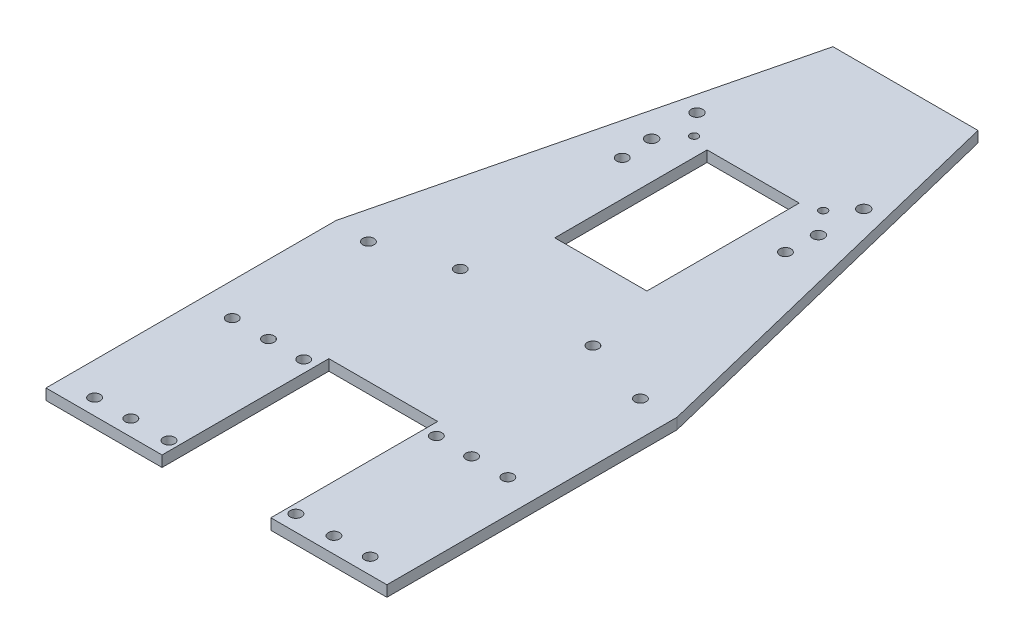
from build123d import *

# Parameters (mm, degrees)
BODY_DEPTH             = 3
SKETCH4_R              = 1.55
MOTOR_MOUNT_DEPTH      = 3
SKETCH5_R              = 1.1
SKETCH5_W              = 25.4
SKETCH5_H              = 42
PROTOBOARD_MOUNT_DEPTH = 10
SKETCH6_R              = 1.6
CASTER_MOUNT_DEPTH     = 10
SKETCH8_R              = 1.55
STAND_OFF_MOUNT_DEPTH  = 10


with BuildPart() as part:
    # Sketch3 → Body (new body)
    with BuildSketch(Plane(origin=(0, 0, 0), x_dir=(1, 0, 0), z_dir=(0, 1, 0))):
        Polygon((-15, -46), (-47, -46), (-47, 34), (-20, 144), (20, 144), (47, 34), (47, -46), (15, -46), (15, 0), (-15, 0), align=None)
    extrude(amount=BODY_DEPTH)

    # Sketch4 → Motor Mount (cut)
    with BuildSketch(Plane(origin=(0, 3, 0), x_dir=(1, 0, 0), z_dir=(0, 1, 0))):
        with Locations(Location((-38, -3.65, 0), (0, 0, 270))):
            Circle(SKETCH4_R)
        with Locations(Location((-28, -3.65, 0), (0, 0, 270))):
            Circle(SKETCH4_R)
        with Locations(Location((-38, -41.6, 0), (0, 0, 270))):
            Circle(SKETCH4_R)
        with Locations(Location((-28, -41.6, 0), (0, 0, 270))):
            Circle(SKETCH4_R)
        with Locations(Location((-18.29, -3.65, 0), (0, 0, 270))):
            Circle(SKETCH4_R)
        with Locations(Location((18.29, -3.65, 0), (0, 0, 90))):
            Circle(SKETCH4_R)
        with Locations(Location((28, -41.6, 0), (0, 0, 90))):
            Circle(SKETCH4_R)
        with Locations(Location((38, -41.6, 0), (0, 0, 90))):
            Circle(SKETCH4_R)
        with Locations(Location((28, -3.65, 0), (0, 0, 90))):
            Circle(SKETCH4_R)
        with Locations(Location((38, -3.65, 0), (0, 0, 90))):
            Circle(SKETCH4_R)
        with Locations(Location((-18.29, 39.53, 0), (0, 0, 270))):
            Circle(SKETCH4_R)
        with Locations(Location((18.29, 39.53, 0), (0, 0, 270))):
            Circle(SKETCH4_R)
    extrude(amount=-MOTOR_MOUNT_DEPTH, mode=Mode.SUBTRACT)

    # Sketch5 → Protoboard Mount (cut)
    with BuildSketch(Plane(origin=(0, 3, 0), x_dir=(1, 0, 0), z_dir=(0, 1, 0))):
        with Locations(Location((-17.8, 103.5, 0), (0, 0, 270))):
            Circle(SKETCH5_R)
        with Locations(Location((17.8, 103.5, 0), (0, 0, 270))):
            Circle(SKETCH5_R)
        with Locations((0, 81)):
            Rectangle(SKETCH5_W, SKETCH5_H)
    extrude(amount=-PROTOBOARD_MOUNT_DEPTH, mode=Mode.SUBTRACT)

    # Sketch6 → Caster Mount (cut)
    with BuildSketch(Plane(origin=(0, 3, 0), x_dir=(1, 0, 0), z_dir=(0, 1, 0))):
        with Locations(Location((-23, 109.5, 0), (0, 0, 270))):
            Circle(SKETCH6_R)
        with Locations(Location((-23, 97, 0), (0, 0, 270))):
            Circle(SKETCH6_R)
        with Locations(Location((23, 97, 0), (0, 0, 270))):
            Circle(SKETCH6_R)
        with Locations(Location((23, 109.5, 0), (0, 0, 270))):
            Circle(SKETCH6_R)
    extrude(amount=-CASTER_MOUNT_DEPTH, mode=Mode.SUBTRACT)

    # Sketch8 → Stand Off Mount (cut)
    with BuildSketch(Plane(origin=(0, 3, 0), x_dir=(1, 0, 0), z_dir=(0, 1, 0))):
        with Locations(Location((-22.5, 88.4, 0), (0, 0, 270))):
            Circle(SKETCH8_R)
        with Locations(Location((22.5, 88.4, 0), (0, 0, 270))):
            Circle(SKETCH8_R)
        with Locations(Location((37.5, 33.4, 0), (0, 0, 270))):
            Circle(SKETCH8_R)
        with Locations(Location((-37.5, 33.4, 0), (0, 0, 270))):
            Circle(SKETCH8_R)
        with Locations(Location((-17.5, -41.6, 0), (0, 0, 270))):
            Circle(SKETCH8_R)
        with Locations(Location((17.5, -41.6, 0), (0, 0, 270))):
            Circle(SKETCH8_R)
    extrude(amount=-STAND_OFF_MOUNT_DEPTH, mode=Mode.SUBTRACT)


solid = part.part
